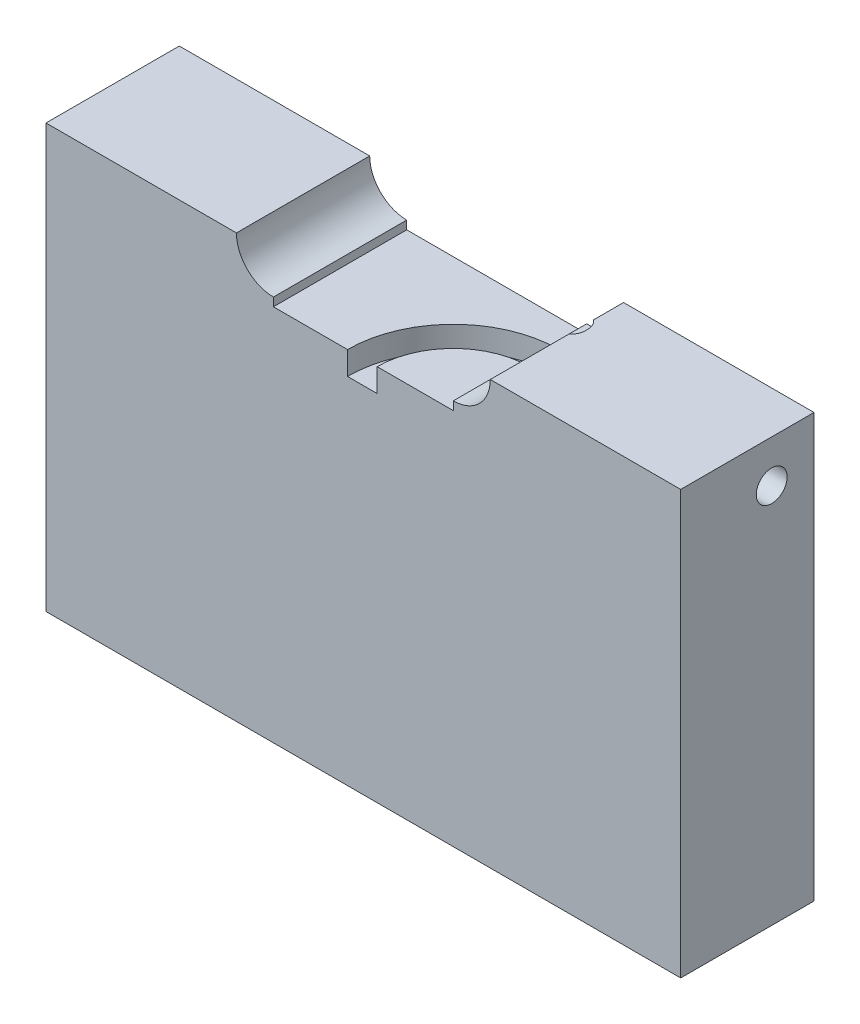
from build123d import *

# Parameters (mm, degrees)
SKETCH1_W               = 38.1
SKETCH1_H               = 8.001
BOSS_EXTRUDE1_DEPTH     = 25.4
CUT_EXTRUDE1_DEPTH      = 25.4
CUT_EXTRUDE2_DEPTH      = 31.267193568
CUT_EXTRUDE2_DEPTH_BACK = 1.905
SKETCH5_R               = 0.9271
CUT_EXTRUDE3_DEPTH      = 12.7
SKETCH6_W               = 10.795
SKETCH6_H               = 8.001
CUT_EXTRUDE4_DEPTH      = 0.508


with BuildPart() as part:
    # Sketch1 → Boss-Extrude1 (new body)
    with BuildSketch(Plane(origin=(0, 0, 0), x_dir=(1, 0, 0), z_dir=(0, 1, 0))):
        Rectangle(SKETCH1_W, SKETCH1_H)
    extrude(amount=BOSS_EXTRUDE1_DEPTH)

    # Sketch2 → Cut-Extrude1 (cut)
    with BuildSketch(Plane(origin=(0, 0, -4.0005), x_dir=(-1, 0, 0), z_dir=(0, 0, -1))):
        with BuildLine():
            Line((5.3975, 23.1775), (-5.3975, 23.1775))
            ThreePointArc((-5.3975, 23.1775), (-7.62, 25.4), (-5.3975, 27.6225))
            Line((-5.3975, 27.6225), (5.3975, 27.6225))
            ThreePointArc((5.3975, 27.6225), (7.62, 25.4), (5.3975, 23.1775))
        make_face()
    extrude(amount=-CUT_EXTRUDE1_DEPTH, mode=Mode.SUBTRACT)

    # Sketch4 → Cut-Extrude2 (cut, two sides: drawn at the far end of the back side and taken through both)
    with BuildSketch(Plane(origin=(0, 23.1775, 0), x_dir=(1, 0, 0), z_dir=(0, 1, 0)).offset(-CUT_EXTRUDE2_DEPTH_BACK)):
        with BuildLine():
            Line((0.8255, -4.0005), (-0.9525, -4.0005))
            ThreePointArc((-0.9525, -4.0005), (0.907371939, 0.489628061), (5.3975, 2.3495))
            Line((5.3975, 2.3495), (7.14375, 2.3495))
            ThreePointArc((7.14375, 2.3495), (7.705016008, 2.117016008), (7.9375, 1.55575))
            Line((7.9375, 1.55575), (7.9375, 1.36525))
            ThreePointArc((7.9375, 1.36525), (7.705016008, 0.803983992), (7.14375, 0.5715))
            Line((7.14375, 0.5715), (5.3975, 0.5715))
            ThreePointArc((5.3975, 0.5715), (2.164607796, -0.767607796), (0.8255, -4.0005))
        make_face()
    extrude(amount=CUT_EXTRUDE2_DEPTH + CUT_EXTRUDE2_DEPTH_BACK, mode=Mode.SUBTRACT)

    # Sketch5 → Cut-Extrude3 (cut)
    with BuildSketch(Plane(origin=(19.05, 0, 0), x_dir=(0, 0, -1), z_dir=(1, 0, 0))):
        with Locations((1.4605, 22.86)):
            Circle(SKETCH5_R)
    extrude(amount=-CUT_EXTRUDE3_DEPTH, mode=Mode.SUBTRACT)

    # Sketch6 → Cut-Extrude4 (cut)
    with BuildSketch(Plane(origin=(0, 23.1775, 0), x_dir=(1, 0, 0), z_dir=(0, 1, 0))):
        Rectangle(SKETCH6_W, SKETCH6_H)
    extrude(amount=-CUT_EXTRUDE4_DEPTH, mode=Mode.SUBTRACT)


solid = part.part
